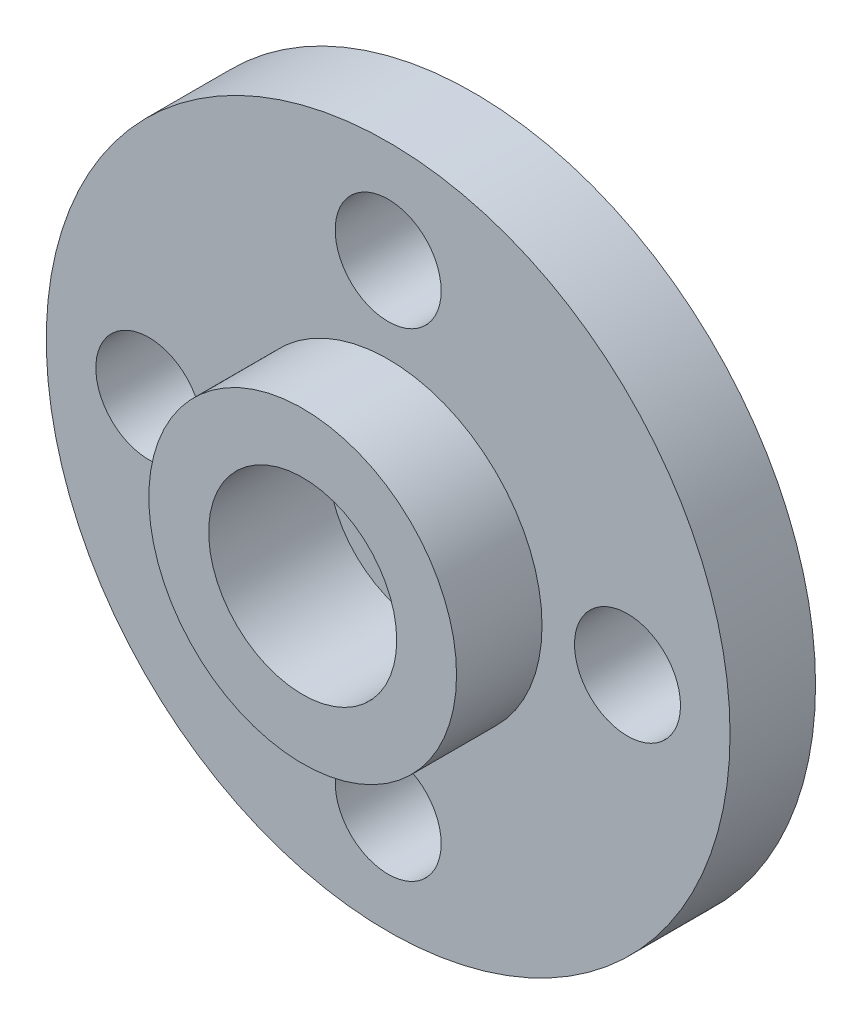
from build123d import *

# Parameters (mm, degrees)
SKETCH1_R               = 10
BOSS_EXTRUDE1_DEPTH     = 2.5
SKETCH2_R               = 4.5
SKETCH2_R_2             = 2.75
EXTRUDE_THIN1_DEPTH     = 2.5
CUT_EXTRUDE1_DEPTH      = 15.361406616
CUT_EXTRUDE1_DEPTH_BACK = 15.361406616
SKETCH3_R               = 1.55
CUT_EXTRUDE2_START      = -1
SKETCH4_R               = 2.75
CUT_EXTRUDE2_DEPTH      = 1


with BuildPart() as part:
    # Sketch1 → Boss-Extrude1 (new body)
    with BuildSketch(Plane(origin=(0, 0, 0), x_dir=(0, 1, 0), z_dir=(0, 0, 1))):
        with Locations(Location((0, 0, 0), (0, 0, 270))):
            Circle(SKETCH1_R)
    extrude(amount=BOSS_EXTRUDE1_DEPTH)

    # Sketch2 → Extrude-Thin1 (add)
    with BuildSketch(Plane.XY.offset(2.5)):
        Circle(SKETCH2_R)
        Circle(SKETCH2_R_2, mode=Mode.SUBTRACT)
    extrude(amount=EXTRUDE_THIN1_DEPTH)

    # Sketch3 → Cut-Extrude1 (cut, two sides: drawn at the far end of the back side and taken through both)
    with BuildSketch(Plane.XY.offset(2.5).offset(-CUT_EXTRUDE1_DEPTH_BACK)):
        Circle(SKETCH3_R)
        with Locations((7, 0)):
            Circle(SKETCH3_R)
        with Locations((0, 7)):
            Circle(SKETCH3_R)
        with Locations((-7, 0)):
            Circle(SKETCH3_R)
        with Locations((0, -7)):
            Circle(SKETCH3_R)
    extrude(amount=CUT_EXTRUDE1_DEPTH + CUT_EXTRUDE1_DEPTH_BACK, mode=Mode.SUBTRACT)

    # Sketch4 → Cut-Extrude2 (cut)
    with BuildSketch(Plane.XY.offset(2.5).offset(CUT_EXTRUDE2_START)):
        Circle(SKETCH4_R)
    extrude(amount=CUT_EXTRUDE2_DEPTH, mode=Mode.SUBTRACT)


solid = part.part
